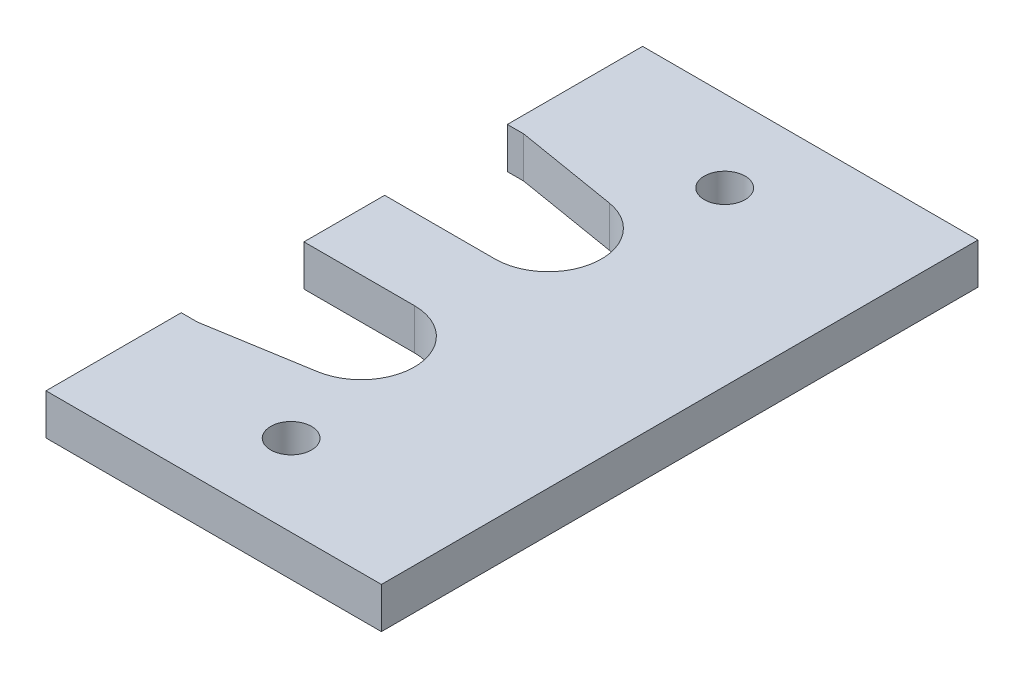
from build123d import *

# Parameters (mm, degrees)
SKETCH2_R           = 2.5
BOSS_EXTRUDE1_DEPTH = 5


with BuildPart() as part:
    # Sketch2 → Boss-Extrude1 (new body)
    with BuildSketch(Plane(origin=(0, 0, 0), x_dir=(1, 0, 0), z_dir=(0, 1, 0))):
        with BuildLine():
            Line((-5.298765278, -43.948074933), (35.701234722, -43.948074933))
            Line((35.701234722, -43.948074933), (35.701234722, 28.983136785))
            Line((35.701234722, 28.983136785), (-5.298765278, 28.983136785))
            Line((-5.298765278, 28.983136785), (-5.298765278, 12.448742644))
            Line((-5.298765278, 12.448742644), (-3.298765278, 12.448742644))
            Line((-3.298765278, 12.448742644), (9.26668749, 10.3608258))
            ThreePointArc((9.26668749, 10.3608258), (14.679218224, 3.414205702), (8.201234722, -2.551257356))
            Line((8.201234722, -2.551257356), (-5.298765278, -2.551257356))
            Line((-5.298765278, -2.551257356), (-5.298765278, -12.413680791))
            Line((-5.298765278, -12.413680791), (8.201234722, -12.413680791))
            ThreePointArc((8.201234722, -12.413680791), (14.679218224, -18.379143849), (9.26668749, -25.325763948))
            Line((9.26668749, -25.325763948), (-3.298765278, -27.413680791))
            Line((-3.298765278, -27.413680791), (-5.298765278, -27.413680791))
            Line((-5.298765278, -27.413680791), (-5.298765278, -43.948074933))
        make_face()
        with Locations(Location((14.701234722, -33.982469074, 0), (0, 0, 90))):
            Circle(SKETCH2_R, mode=Mode.SUBTRACT)
        with Locations(Location((14.701234722, 19.017530926, 0), (0, 0, 270))):
            Circle(SKETCH2_R, mode=Mode.SUBTRACT)
    extrude(amount=BOSS_EXTRUDE1_DEPTH)


solid = part.part
